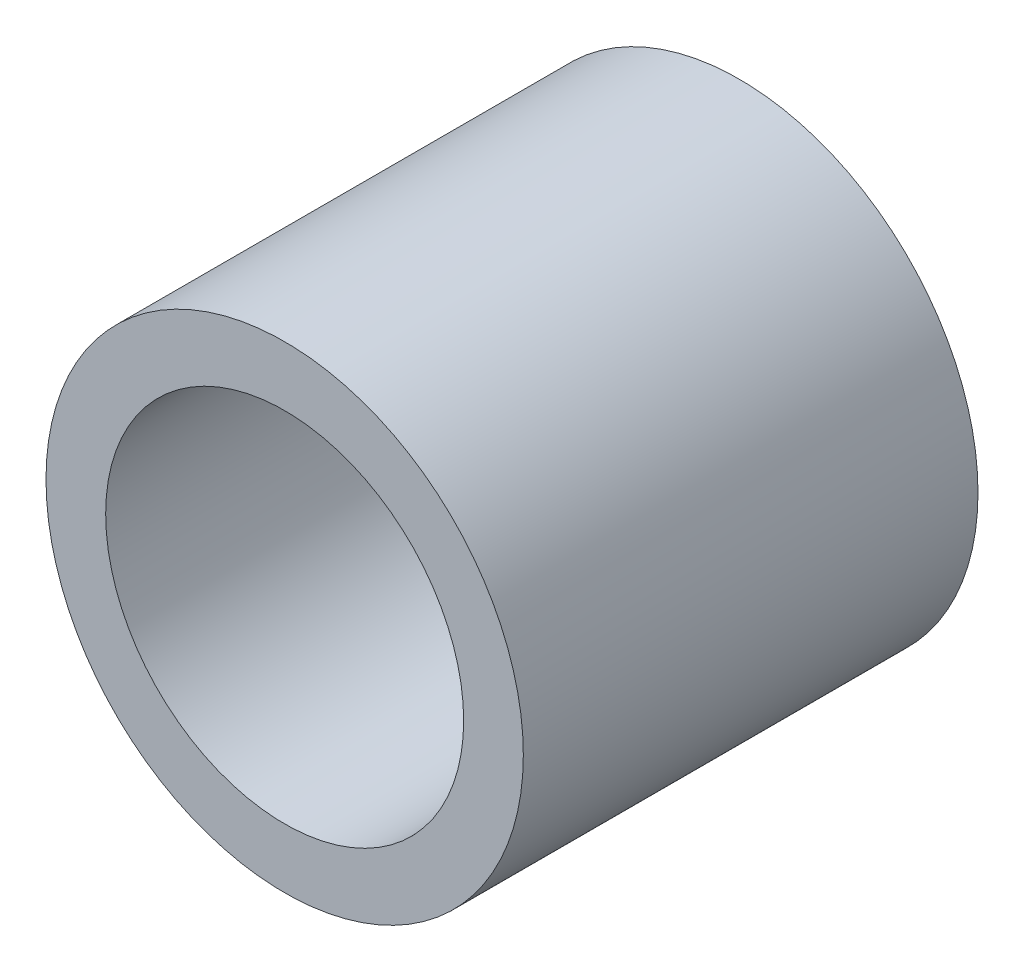
from build123d import *

# Parameters (mm, degrees)
SKETCH1_R      = 2
SKETCH1_R_2    = 1.5
EXTRUDE1_DEPTH = 3.81


with BuildPart() as part:
    # Sketch1 → Extrude1 (new body)
    with BuildSketch(Plane.XY):
        with Locations(Location((0, 0, 0), (0, 0, 180))):
            Circle(SKETCH1_R)
        with Locations(Location((0, 0, 0), (0, 0, 180))):
            Circle(SKETCH1_R_2, mode=Mode.SUBTRACT)
    extrude(amount=EXTRUDE1_DEPTH)


solid = part.part
